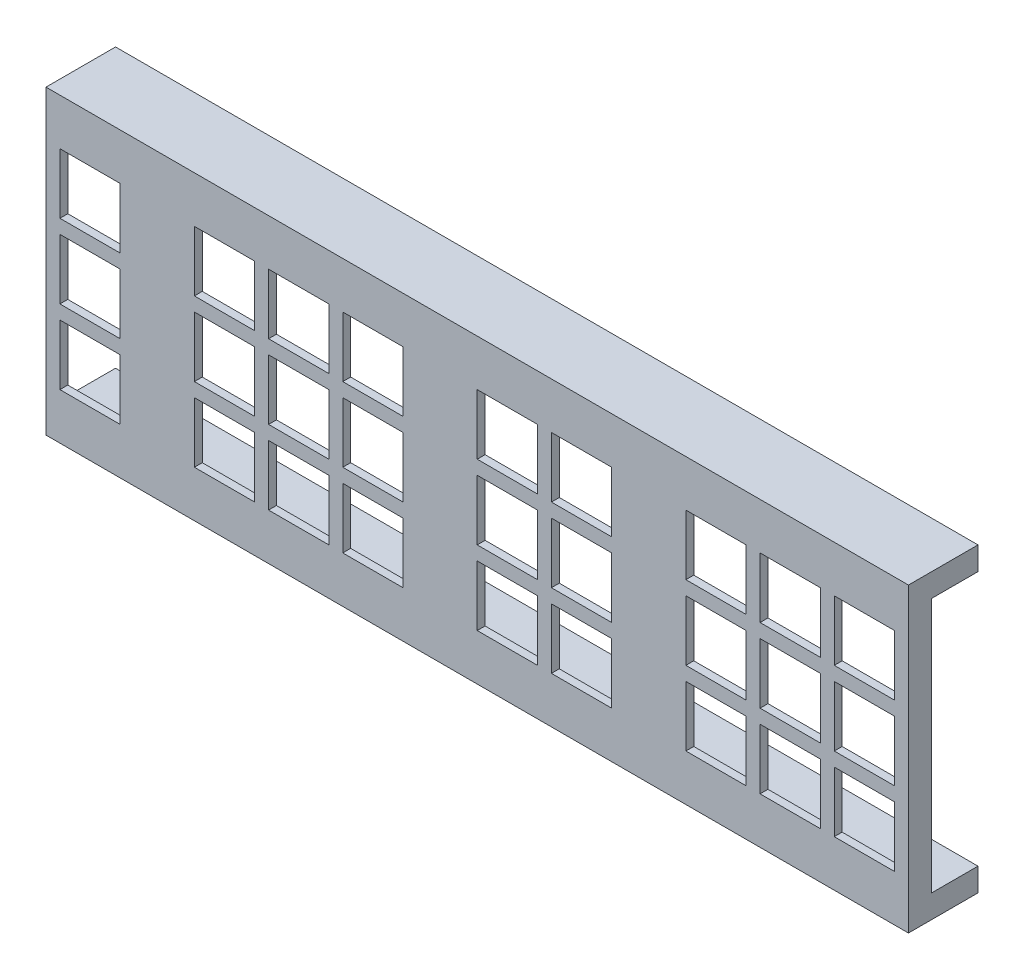
from build123d import *

# Parameters (mm, degrees)
ESQUISSE1_W                     = 186
ESQUISSE1_H                     = 51
BOSS_EXTRU_1_DEPTH              = 35
ESQUISSE7_W                     = 13
ESQUISSE7_H                     = 13
ENL_V_MAT_EXTRU_5_DEPTH         = 91
R_P_TITION_LIN_AIRE5_COUNT      = 3
R_P_TITION_LIN_AIRE5_PITCH      = 16
ESQUISSE8_W                     = 13
ESQUISSE8_H                     = 13
ENL_V_MAT_EXTRU_6_DEPTH         = 103
R_P_TITION_LIN_AIRE6_COUNT      = 3
R_P_TITION_LIN_AIRE6_PITCH      = 16
R_P_TITION_LIN_AIRE6_COUNT_DIR2 = 3
R_P_TITION_LIN_AIRE6_PITCH_DIR2 = 16
ESQUISSE9_W                     = 13
ESQUISSE9_H                     = 13
ENL_V_MAT_EXTRU_7_DEPTH         = 77
R_P_TITION_LIN_AIRE7_COUNT      = 3
R_P_TITION_LIN_AIRE7_PITCH      = 16
R_P_TITION_LIN_AIRE7_COUNT_DIR2 = 2
R_P_TITION_LIN_AIRE7_PITCH_DIR2 = 16
ESQUISSE10_W                    = 13
ESQUISSE10_H                    = 13
ENL_V_MAT_EXTRU_8_DEPTH         = 78
R_P_TITION_LIN_AIRE8_COUNT      = 3
R_P_TITION_LIN_AIRE8_PITCH      = 16
R_P_TITION_LIN_AIRE8_COUNT_DIR2 = 3
R_P_TITION_LIN_AIRE8_PITCH_DIR2 = 16
ESQUISSE14_W                    = 10
ESQUISSE14_H                    = 5
BOSS_EXTRU_3_DEPTH              = 7
ESQUISSE25_W                    = 186
ESQUISSE25_H                    = 35
BOSS_EXTRU_7_DEPTH              = 7
ESQUISSE18_W                    = 186
ESQUISSE18_H                    = 35
BOSS_EXTRU_5_DEPTH              = 7
ESQUISSE16_W                    = 3.3
ESQUISSE16_H                    = 55
ENL_V_MAT_EXTRU_11_DEPTH        = 184
ESQUISSE15_R                    = 1
ENL_V_MAT_EXTRU_10_DEPTH        = 7
ESQUISSE24_W                    = 10
ESQUISSE24_H                    = 2
ENL_V_MAT_EXTRU_12_DEPTH        = 1
ESQUISSE19_W                    = 186
ESQUISSE19_H                    = 1
ESQUISSE19_W_2                  = 1
ESQUISSE19_H_2                  = 63
BOSS_EXTRU_8_DEPTH              = 30
ESQUISSE26_R                    = 1.75
ENL_V_MAT_EXTRU_14_DEPTH        = 30
ESQUISSE27_R                    = 1.75
ENL_V_MAT_EXTRU_20_DEPTH        = 198.952014387


with BuildPart() as part:
    # Esquisse1 → Boss.-Extru.1 (new body)
    with BuildSketch(Plane.XY):
        with Locations((0, -25.5)):
            Rectangle(ESQUISSE1_W, ESQUISSE1_H)
    extrude(amount=BOSS_EXTRU_1_DEPTH)

    # Esquisse7 → Enlèv. mat.-Extru.5 (cut)
    with BuildSketch(Plane.XY.offset(35)):
        with Locations((-83.5, -9.5)):
            Rectangle(ESQUISSE7_W, ESQUISSE7_H)
    enl_v_mat_extru_5 = extrude(amount=-ENL_V_MAT_EXTRU_5_DEPTH, mode=Mode.SUBTRACT)

    # Répétition linéaire5: Enlèv. mat.-Extru.5 ×3
    with Locations(*[(0, -i * R_P_TITION_LIN_AIRE5_PITCH, 0) for i in range(1, R_P_TITION_LIN_AIRE5_COUNT)]):
        add(enl_v_mat_extru_5, mode=Mode.SUBTRACT)

    # Esquisse8 → Enlèv. mat.-Extru.6 (cut)
    with BuildSketch(Plane.XY.offset(35)):
        with Locations((-54.5, -9.5)):
            Rectangle(ESQUISSE8_W, ESQUISSE8_H)
    enl_v_mat_extru_6 = extrude(amount=-ENL_V_MAT_EXTRU_6_DEPTH, mode=Mode.SUBTRACT)

    # Répétition linéaire6: Enl_v. mat.-Extru.6 3 × 3
    with Locations(*[(j * R_P_TITION_LIN_AIRE6_PITCH_DIR2, -i * R_P_TITION_LIN_AIRE6_PITCH, 0) for i in range(R_P_TITION_LIN_AIRE6_COUNT) for j in range(R_P_TITION_LIN_AIRE6_COUNT_DIR2) if (i, j) != (0, 0)]):
        add(enl_v_mat_extru_6, mode=Mode.SUBTRACT)

    # Esquisse9 → Enlèv. mat.-Extru.7 (cut)
    with BuildSketch(Plane.XY.offset(35)):
        with Locations((6.5, -9.5)):
            Rectangle(ESQUISSE9_W, ESQUISSE9_H)
    enl_v_mat_extru_7 = extrude(amount=-ENL_V_MAT_EXTRU_7_DEPTH, mode=Mode.SUBTRACT)

    # Répétition linéaire7: Enl_v. mat.-Extru.7 3 × 2
    with Locations(*[(j * R_P_TITION_LIN_AIRE7_PITCH_DIR2, -i * R_P_TITION_LIN_AIRE7_PITCH, 0) for i in range(R_P_TITION_LIN_AIRE7_COUNT) for j in range(R_P_TITION_LIN_AIRE7_COUNT_DIR2) if (i, j) != (0, 0)]):
        add(enl_v_mat_extru_7, mode=Mode.SUBTRACT)

    # Esquisse10 → Enlèv. mat.-Extru.8 (cut)
    with BuildSketch(Plane.XY.offset(35)):
        with Locations((51.5, -9.5)):
            Rectangle(ESQUISSE10_W, ESQUISSE10_H)
    enl_v_mat_extru_8 = extrude(amount=-ENL_V_MAT_EXTRU_8_DEPTH, mode=Mode.SUBTRACT)

    # Répétition linéaire8: Enl_v. mat.-Extru.8 3 × 3
    with Locations(*[(i * R_P_TITION_LIN_AIRE8_PITCH, -j * R_P_TITION_LIN_AIRE8_PITCH_DIR2, 0) for i in range(R_P_TITION_LIN_AIRE8_COUNT) for j in range(R_P_TITION_LIN_AIRE8_COUNT_DIR2) if (i, j) != (0, 0)]):
        add(enl_v_mat_extru_8, mode=Mode.SUBTRACT)

    # Esquisse14 → Boss.-Extru.3 (add)
    with BuildSketch(Plane.XZ.offset(51)):
        with Locations((-7.663083533, 2.5)):
            Rectangle(ESQUISSE14_W, ESQUISSE14_H)
    extrude(amount=BOSS_EXTRU_3_DEPTH)

    # Esquisse25 → Boss.-Extru.7 (add)
    with BuildSketch(Plane(origin=(0, 0, 0), x_dir=(1, 0, 0), z_dir=(0, 1, 0))):
        with Locations((0, -17.5)):
            Rectangle(ESQUISSE25_W, ESQUISSE25_H)
    extrude(amount=BOSS_EXTRU_7_DEPTH)

    # Esquisse18 → Boss.-Extru.5 (add)
    with BuildSketch(Plane.XZ.offset(51)):
        with Locations((0, 17.5)):
            Rectangle(ESQUISSE18_W, ESQUISSE18_H)
    extrude(amount=BOSS_EXTRU_5_DEPTH)

    # Esquisse16 → Enlèv. mat.-Extru.11 (cut)
    with BuildSketch(Plane.ZY.offset(93)):
        with Locations((31.65, -25.5)):
            Rectangle(ESQUISSE16_W, ESQUISSE16_H)
    extrude(amount=-ENL_V_MAT_EXTRU_11_DEPTH, mode=Mode.SUBTRACT)

    # Esquisse15 → Enlèv. mat.-Extru.10 (cut)
    with BuildSketch(Plane(origin=(0, 0, 0), x_dir=(-1, 0, 0), z_dir=(0, 0, -1))):
        with Locations((8.482305804, -42.446555864)):
            Circle(ESQUISSE15_R)
        with Locations((8.482305804, -9.749028666)):
            Circle(ESQUISSE15_R)
        with Locations((68.823038652, -42.446555864)):
            Circle(ESQUISSE15_R)
        with Locations((68.823038652, -9.749028666)):
            Circle(ESQUISSE15_R)
        with Locations((-37.13548256, -42.446555864)):
            Circle(ESQUISSE15_R)
        with Locations((-39.215855023, -11.260648292)):
            Circle(ESQUISSE15_R)
    extrude(amount=-ENL_V_MAT_EXTRU_10_DEPTH, mode=Mode.SUBTRACT)

    # Esquisse24 → Enlèv. mat.-Extru.12 (cut)
    with BuildSketch(Plane(origin=(0, 0, 0), x_dir=(-1, 0, 0), z_dir=(0, 0, -1))):
        with Locations((83.5, -49)):
            Rectangle(ESQUISSE24_W, ESQUISSE24_H)
        with Locations((54.5, -49)):
            Rectangle(ESQUISSE24_W, ESQUISSE24_H)
        with Locations((38.5, -49)):
            Rectangle(ESQUISSE24_W, ESQUISSE24_H)
        with Locations((22.5, -49)):
            Rectangle(ESQUISSE24_W, ESQUISSE24_H)
        with Locations((-6.5, -49)):
            Rectangle(ESQUISSE24_W, ESQUISSE24_H)
        with Locations((-22.5, -49)):
            Rectangle(ESQUISSE24_W, ESQUISSE24_H)
        with Locations((-51.5, -49)):
            Rectangle(ESQUISSE24_W, ESQUISSE24_H)
        with Locations((-67.5, -49)):
            Rectangle(ESQUISSE24_W, ESQUISSE24_H)
        with Locations((-83.5, -49)):
            Rectangle(ESQUISSE24_W, ESQUISSE24_H)
        with Locations((-83.5, -2)):
            Rectangle(ESQUISSE24_W, ESQUISSE24_H)
        with Locations((-67.5, -2)):
            Rectangle(ESQUISSE24_W, ESQUISSE24_H)
        with Locations((-51.5, -2)):
            Rectangle(ESQUISSE24_W, ESQUISSE24_H)
        with Locations((-22.5, -2)):
            Rectangle(ESQUISSE24_W, ESQUISSE24_H)
        with Locations((-6.5, -2)):
            Rectangle(ESQUISSE24_W, ESQUISSE24_H)
        with Locations((22.5, -2)):
            Rectangle(ESQUISSE24_W, ESQUISSE24_H)
        with Locations((38.5, -2)):
            Rectangle(ESQUISSE24_W, ESQUISSE24_H)
        with Locations((54.5, -2)):
            Rectangle(ESQUISSE24_W, ESQUISSE24_H)
        with Locations((83.5, -2)):
            Rectangle(ESQUISSE24_W, ESQUISSE24_H)
    extrude(amount=-ENL_V_MAT_EXTRU_12_DEPTH, mode=Mode.SUBTRACT)

    # Esquisse19 → Boss.-Extru.8 (add)
    with BuildSketch(Plane(origin=(0, 0, 0), x_dir=(-1, 0, 0), z_dir=(0, 0, -1))):
        with Locations((0, -57.5)):
            Rectangle(ESQUISSE19_W, ESQUISSE19_H)
        with Locations((92.5, -25.5)):
            Rectangle(ESQUISSE19_W_2, ESQUISSE19_H_2)
        with Locations((0, 6.5)):
            Rectangle(ESQUISSE19_W, ESQUISSE19_H)
        with Locations((-92.5, -25.5)):
            Rectangle(ESQUISSE19_W_2, ESQUISSE19_H_2)
    extrude(amount=BOSS_EXTRU_8_DEPTH)

    # Esquisse26 → Enlèv. mat.-Extru.14 (cut)
    with BuildSketch(Plane.ZY.offset(93)):
        with Locations((-13.75, -25.5)):
            Circle(ESQUISSE26_R)
    extrude(amount=-ENL_V_MAT_EXTRU_14_DEPTH, mode=Mode.SUBTRACT)

    # Esquisse27 → Enlèv. mat.-Extru.20 (cut, through all)
    # profile 1 of 2: a face of its own
    with BuildSketch(Plane.ZY.offset(93)):
        Polygon((30, -53), (30, 2), (20, 2), (20, 7), (-30, 7), (-30, -58), (20, -58), (20, -53), align=None)
        with Locations((-13.75, -25.5)):
            Circle(ESQUISSE27_R, mode=Mode.SUBTRACT)
    # profile 2 of 2: a face of its own
    with BuildSketch(Plane.ZY.offset(93)):
        with Locations((-13.75, -25.5)):
            Circle(ESQUISSE27_R)
    extrude(amount=-ENL_V_MAT_EXTRU_20_DEPTH, mode=Mode.SUBTRACT)


solid = part.part
